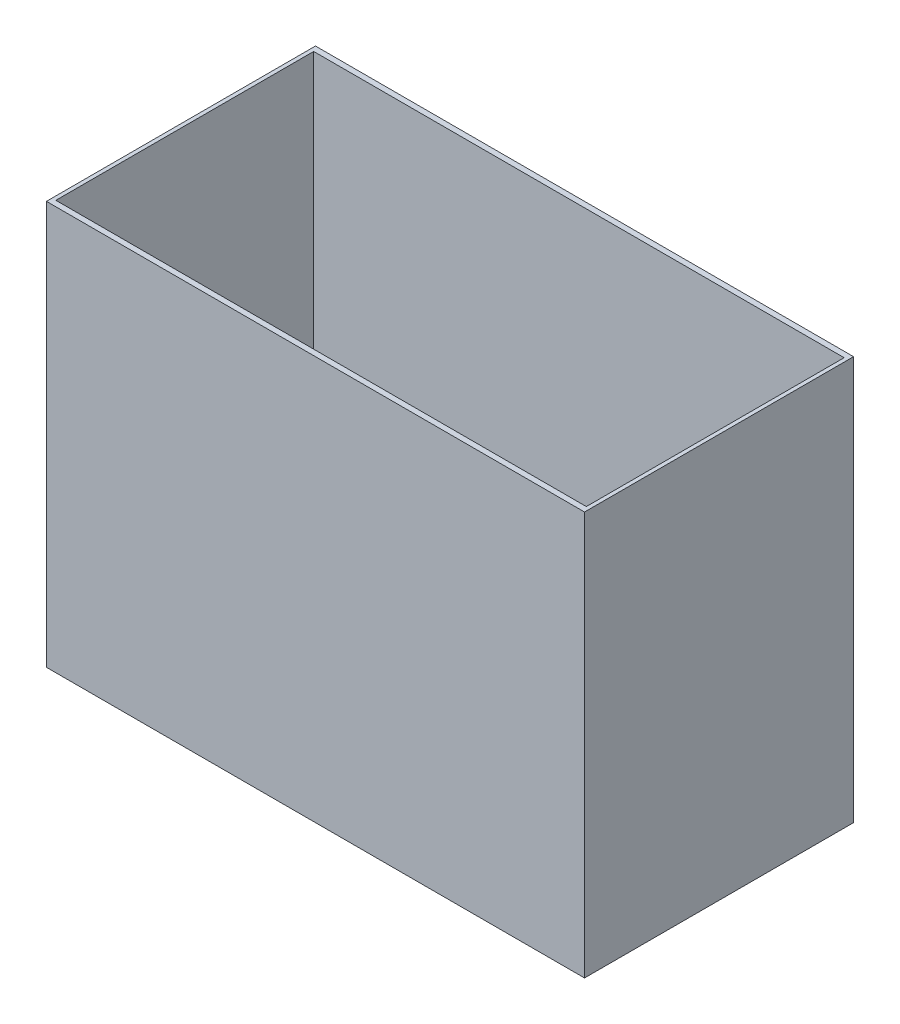
from build123d import *

# Parameters (mm, degrees)
SKETCH1_W           = 127
SKETCH1_H           = 279.4
BOSS_EXTRUDE1_DEPTH = 6.35
SKETCH3_W           = 609.6
SKETCH3_H           = 304.8
SKETCH3_W_2         = 600.964
SKETCH3_H_2         = 292.1
BOSS_EXTRUDE3_DEPTH = 457.2
SKETCH4_R           = 21.038100037
CUT_EXTRUDE1_DEPTH  = 566.15
SKETCH5_W           = 6.35
SKETCH5_H           = 25.4
CUT_EXTRUDE2_DEPTH  = 566.15


with BuildPart() as part:
    # Sketch1 → Boss-Extrude1 (new body)
    with BuildSketch(Plane(origin=(0, 0, 0), x_dir=(1, 0, 0), z_dir=(0, 1, 0))):
        with Locations((228.6, 0)):
            Rectangle(SKETCH1_W, SKETCH1_H)
    extrude(amount=BOSS_EXTRUDE1_DEPTH)

    # Sketch4 → Cut-Extrude1 (cut, through all)
    with BuildSketch(Plane(origin=(0, 6.35, 0), x_dir=(1, 0, 0), z_dir=(0, 1, 0))):
        with Locations(Location((252.011899963, 99.611899963, 0), (0, 0, 270))):
            Circle(SKETCH4_R)
    cut_extrude1 = extrude(amount=-CUT_EXTRUDE1_DEPTH, mode=Mode.SUBTRACT)

    # Mirror1: Cut-Extrude1 across plane
    add(cut_extrude1.mirror(Plane.XY), mode=Mode.SUBTRACT)

    # Sketch5 → Cut-Extrude2 (cut, through all)
    with BuildSketch(Plane(origin=(0, 6.35, 0), x_dir=(1, 0, 0), z_dir=(0, 1, 0))):
        with Locations((288.925, 30.48)):
            Rectangle(SKETCH5_W, SKETCH5_H)
        with Locations((288.925, 91.44)):
            Rectangle(SKETCH5_W, SKETCH5_H)
        with Locations((288.925, -91.44)):
            Rectangle(SKETCH5_W, SKETCH5_H)
        with Locations((288.925, -30.48)):
            Rectangle(SKETCH5_W, SKETCH5_H)
    extrude(amount=-CUT_EXTRUDE2_DEPTH, mode=Mode.SUBTRACT)


with BuildPart() as body_2:
    # Sketch3 → Boss-Extrude3 (new body)
    with BuildSketch(Plane(origin=(0, 0, 0), x_dir=(1, 0, 0), z_dir=(0, 1, 0))):
        Rectangle(SKETCH3_W, SKETCH3_H)
        Rectangle(SKETCH3_W_2, SKETCH3_H_2, mode=Mode.SUBTRACT)
    extrude(amount=BOSS_EXTRUDE3_DEPTH)


solid = Compound([part.part, body_2.part])
